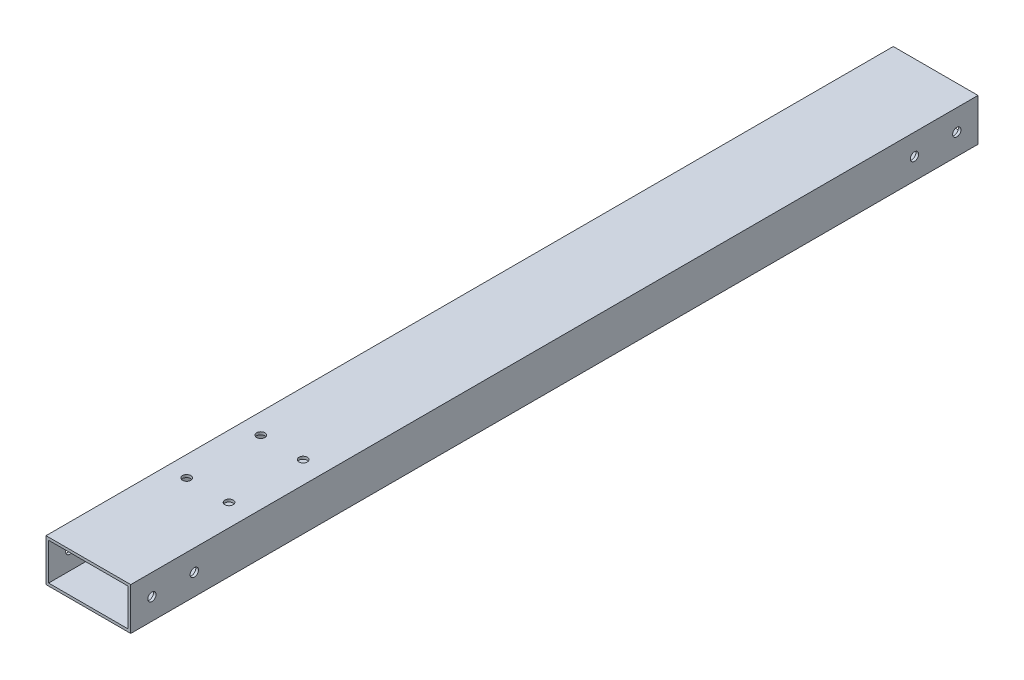
from build123d import *

# Parameters (mm, degrees)
BOSS_EXTRUDE1_DEPTH      = 254.000001
BOSS_EXTRUDE1_DEPTH_BACK = 254.000001
SKETCH3_W                = 50.8
SKETCH3_H                = 25.4
SKETCH3_W_2              = 47.625
SKETCH3_H_2              = 22.225
F_10_CLEARANCE_HOLE1_D   = 4.9784
F_10_CLEARANCE_HOLE2_D   = 4.9784


with BuildPart() as part:
    # Sketch3 → Boss-Extrude1 (new, two sides: drawn at the far end of the back side and taken through both)
    with BuildSketch(Plane.XY.offset(-BOSS_EXTRUDE1_DEPTH_BACK)):
        Rectangle(SKETCH3_W, SKETCH3_H)
        Rectangle(SKETCH3_W_2, SKETCH3_H_2, mode=Mode.SUBTRACT)
    extrude(amount=BOSS_EXTRUDE1_DEPTH + BOSS_EXTRUDE1_DEPTH_BACK)

    # #10 Clearance Hole1 (through all)
    with Locations(Plane(origin=(25.4, 0, 0), x_dir=(0, 0, -1), z_dir=(1, 0, 0))):
        with Locations((-241.300000508, 0), (-215.900000508, 0), (215.899999492, 0), (241.299999492, 0)):
            Hole(F_10_CLEARANCE_HOLE1_D / 2)

    # #10 Clearance Hole2 (through all)
    with Locations(Plane(origin=(0, 12.7, 0), x_dir=(1, 0, 0), z_dir=(0, 1, 0))):
        with Locations((12.19200009, -137.396900508), (-13.20799991, -137.396900508), (-13.20799991, -181.846900508), (12.19200009, -181.846900508)):
            Hole(F_10_CLEARANCE_HOLE2_D / 2)


solid = part.part
